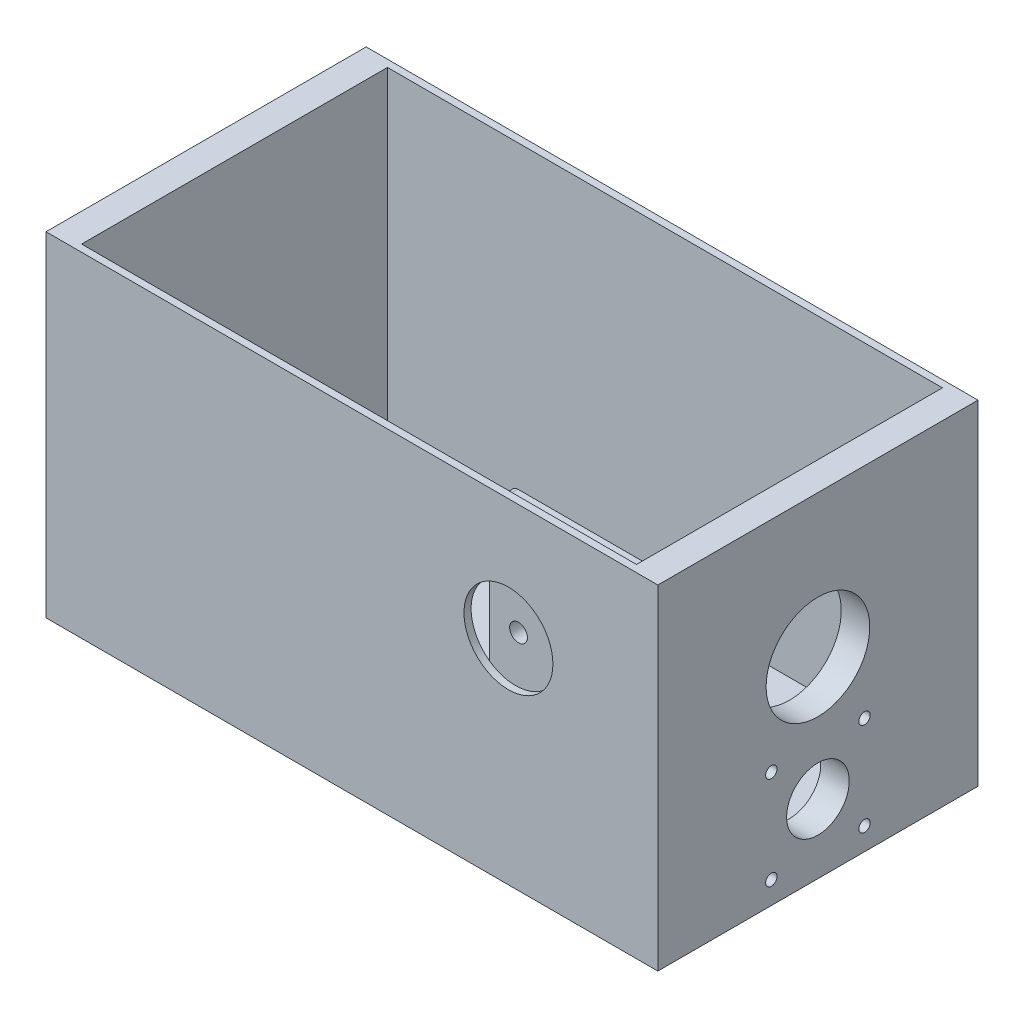
from build123d import *

# Parameters (mm, degrees)
SKETCH1_W           = 203.2
SKETCH1_H           = 114.3
BOSS_EXTRUDE1_DEPTH = 119.38
SHELL1_T            = -2.54
SKETCH2_R           = 18.5
SKETCH2_R_2         = 2.032
SKETCH2_R_3         = 11.176
CUT_EXTRUDE1_DEPTH  = 2.54
SKETCH3_W           = 114.3
SKETCH3_H           = 119.38
SKETCH3_R           = 18.5
SKETCH3_R_2         = 2.032
SKETCH3_R_3         = 11.176
BOSS_EXTRUDE3_DEPTH = 7.62
SKETCH4_R           = 15.875
CUT_EXTRUDE2_DEPTH  = 2.54
SKETCH5_W           = 50.7
SKETCH5_H           = 7.62
BOSS_EXTRUDE4_DEPTH = 95.25
CUT_EXTRUDE3_REACH  = 189.987
SKETCH6_R           = 3.175
FILLET1_R           = 2.54
FILLET2_R           = 2.54
SKETCH7_W           = 114.3
SKETCH7_H           = 119.38
BOSS_EXTRUDE5_DEPTH = 7.62
SKETCH8_R           = 2.54
SKETCH8_R_2         = 1.27
BOSS_EXTRUDE6_DEPTH = 5.08


with BuildPart() as part:
    # Sketch1 → Boss-Extrude1 (new body)
    with BuildSketch(Plane(origin=(0, 0, 0), x_dir=(1, 0, 0), z_dir=(0, 1, 0))):
        Rectangle(SKETCH1_W, SKETCH1_H)
    extrude(amount=BOSS_EXTRUDE1_DEPTH)

    # Shell1
    shell1_openings = [part.faces().sort_by_distance(p)[0] for p in [
        (0, 119.38, 0),
    ]]
    offset(amount=SHELL1_T, openings=shell1_openings, kind=Kind.INTERSECTION)

    # Sketch2 → Cut-Extrude1 (cut)
    with BuildSketch(Plane.ZY.offset(-99.06)):
        with Locations((0, 68.58)):
            Circle(SKETCH2_R)
        with Locations((16.637, 41.275)):
            Circle(SKETCH2_R_2)
        with Locations(Location((16.637, 8.001, 0), (0, 0, 180))):
            Circle(SKETCH2_R_2)
        with Locations((-16.637, 8.001)):
            Circle(SKETCH2_R_2)
        with Locations(Location((-16.637, 41.275, 0), (0, 0, 180))):
            Circle(SKETCH2_R_2)
        with Locations((0, 24.638)):
            Circle(SKETCH2_R_3)
    extrude(amount=-CUT_EXTRUDE1_DEPTH, mode=Mode.SUBTRACT)

    # Sketch3 → Boss-Extrude3 (add)
    with BuildSketch(Plane(origin=(101.6, 0, 0), x_dir=(0, 0, -1), z_dir=(1, 0, 0))):
        with Locations((0, 59.69)):
            Rectangle(SKETCH3_W, SKETCH3_H)
        with Locations(Location((0, 68.58, 0), (0, 0, 180))):
            Circle(SKETCH3_R, mode=Mode.SUBTRACT)
        with Locations((-16.637, 8.001)):
            Circle(SKETCH3_R_2, mode=Mode.SUBTRACT)
        with Locations(Location((16.637, 8.001, 0), (0, 0, 180))):
            Circle(SKETCH3_R_2, mode=Mode.SUBTRACT)
        with Locations((16.637, 41.275)):
            Circle(SKETCH3_R_2, mode=Mode.SUBTRACT)
        with Locations(Location((-16.637, 41.275, 0), (0, 0, 180))):
            Circle(SKETCH3_R_2, mode=Mode.SUBTRACT)
        with Locations(Location((0, 24.638, 0), (0, 0, 180))):
            Circle(SKETCH3_R_3, mode=Mode.SUBTRACT)
    extrude(amount=BOSS_EXTRUDE3_DEPTH)

    # Sketch4 → Cut-Extrude2 (cut)
    with BuildSketch(Plane.XY.offset(57.15)):
        with Locations((55.88, 76.2)):
            Circle(SKETCH4_R)
    extrude(amount=-CUT_EXTRUDE2_DEPTH, mode=Mode.SUBTRACT)

    # Sketch5 → Boss-Extrude4 (add)
    with BuildSketch(Plane(origin=(0, 2.54, 0), x_dir=(1, 0, 0), z_dir=(0, 1, 0))):
        with Locations((55.88, -34.74)):
            Rectangle(SKETCH5_W, SKETCH5_H)
    extrude(amount=BOSS_EXTRUDE4_DEPTH)

    # Sketch6 → Cut-Extrude3 (cut, up to next)
    with BuildSketch(Plane.XY.offset(38.55), mode=Mode.PRIVATE) as cut_extrude3_sk1:
        with Locations((40.88, 91.2)):
            Circle(SKETCH6_R)
    cut_extrude3_tool1 = extrude(cut_extrude3_sk1.sketch, amount=-CUT_EXTRUDE3_REACH, mode=Mode.PRIVATE) & part.part
    # Sketch6 → Cut-Extrude3 (cut, up to next)
    with BuildSketch(Plane.XY.offset(38.55), mode=Mode.PRIVATE) as cut_extrude3_sk2:
        with Locations((70.88, 61.2)):
            Circle(SKETCH6_R)
    cut_extrude3_tool2 = extrude(cut_extrude3_sk2.sketch, amount=-CUT_EXTRUDE3_REACH, mode=Mode.PRIVATE) & part.part
    # Sketch6 → Cut-Extrude3 (cut, up to next)
    with BuildSketch(Plane.XY.offset(38.55), mode=Mode.PRIVATE) as cut_extrude3_sk3:
        with Locations((40.88, 61.2)):
            Circle(SKETCH6_R)
    cut_extrude3_tool3 = extrude(cut_extrude3_sk3.sketch, amount=-CUT_EXTRUDE3_REACH, mode=Mode.PRIVATE) & part.part
    # Sketch6 → Cut-Extrude3 (cut, up to next)
    with BuildSketch(Plane.XY.offset(38.55), mode=Mode.PRIVATE) as cut_extrude3_sk4:
        with Locations((70.88, 91.2)):
            Circle(SKETCH6_R)
    cut_extrude3_tool4 = extrude(cut_extrude3_sk4.sketch, amount=-CUT_EXTRUDE3_REACH, mode=Mode.PRIVATE) & part.part
    add(cut_extrude3_tool1.solids().sort_by_distance((40.88, 91.2, 38.55))[0], mode=Mode.SUBTRACT)
    add(cut_extrude3_tool2.solids().sort_by_distance((70.88, 61.2, 38.55))[0], mode=Mode.SUBTRACT)
    add(cut_extrude3_tool3.solids().sort_by_distance((40.88, 61.2, 38.55))[0], mode=Mode.SUBTRACT)
    add(cut_extrude3_tool4.solids().sort_by_distance((70.88, 91.2, 38.55))[0], mode=Mode.SUBTRACT)

    # Fillet1
    fillet1_edges = [part.edges().sort_by_distance(p)[0] for p in [
        (30.53, 97.79, 34.74),
        (81.23, 97.79, 34.74),
    ]]
    fillet(fillet1_edges, radius=FILLET1_R)

    # Fillet2
    fillet2_edges = [part.edges().sort_by_distance(p)[0] for p in [
        (30.53, 2.54, 34.74),
        (55.88, 2.54, 38.55),
        (81.23, 2.54, 34.74),
        (55.88, 2.54, 30.93),
    ]]
    fillet(fillet2_edges, radius=FILLET2_R)

    # Sketch7 → Boss-Extrude5 (add)
    with BuildSketch(Plane.ZY.offset(101.6)):
        with Locations((0, 59.69)):
            Rectangle(SKETCH7_W, SKETCH7_H)
    extrude(amount=BOSS_EXTRUDE5_DEPTH)

    # Sketch8 → Boss-Extrude6 (add)
    # profile 1 of 4: a face of its own
    with BuildSketch(Plane(origin=(0, 2.54, 0), x_dir=(1, 0, 0), z_dir=(0, 1, 0))):
        with Locations(Location((57.72714395, -23.731482064, 0), (0, 0, 90))):
            Circle(SKETCH8_R)
        with Locations(Location((57.72714395, -23.731482064, 0), (0, 0, 270))):
            Circle(SKETCH8_R_2, mode=Mode.SUBTRACT)
    # profile 2 of 4: a face of its own
    with BuildSketch(Plane(origin=(0, 2.54, 0), x_dir=(1, 0, 0), z_dir=(0, 1, 0))):
        with Locations(Location((59.40714395, 34.233185903, 0), (0, 0, 90))):
            Circle(SKETCH8_R)
        with Locations(Location((59.40714395, 34.233185903, 0), (0, 0, 270))):
            Circle(SKETCH8_R_2, mode=Mode.SUBTRACT)
    # profile 3 of 4: a face of its own
    with BuildSketch(Plane(origin=(0, 2.54, 0), x_dir=(1, 0, 0), z_dir=(0, 1, 0))):
        with Locations(Location((-26.48785605, 34.233185903, 0), (0, 0, 90))):
            Circle(SKETCH8_R)
        with Locations(Location((-26.48785605, 34.233185903, 0), (0, 0, 270))):
            Circle(SKETCH8_R_2, mode=Mode.SUBTRACT)
    # profile 4 of 4: a face of its own
    with BuildSketch(Plane(origin=(0, 2.54, 0), x_dir=(1, 0, 0), z_dir=(0, 1, 0))):
        with Locations(Location((-28.27285605, -23.731482064, 0), (0, 0, 90))):
            Circle(SKETCH8_R)
        with Locations(Location((-28.27285605, -23.731482064, 0), (0, 0, 270))):
            Circle(SKETCH8_R_2, mode=Mode.SUBTRACT)
    extrude(amount=BOSS_EXTRUDE6_DEPTH)


solid = part.part
